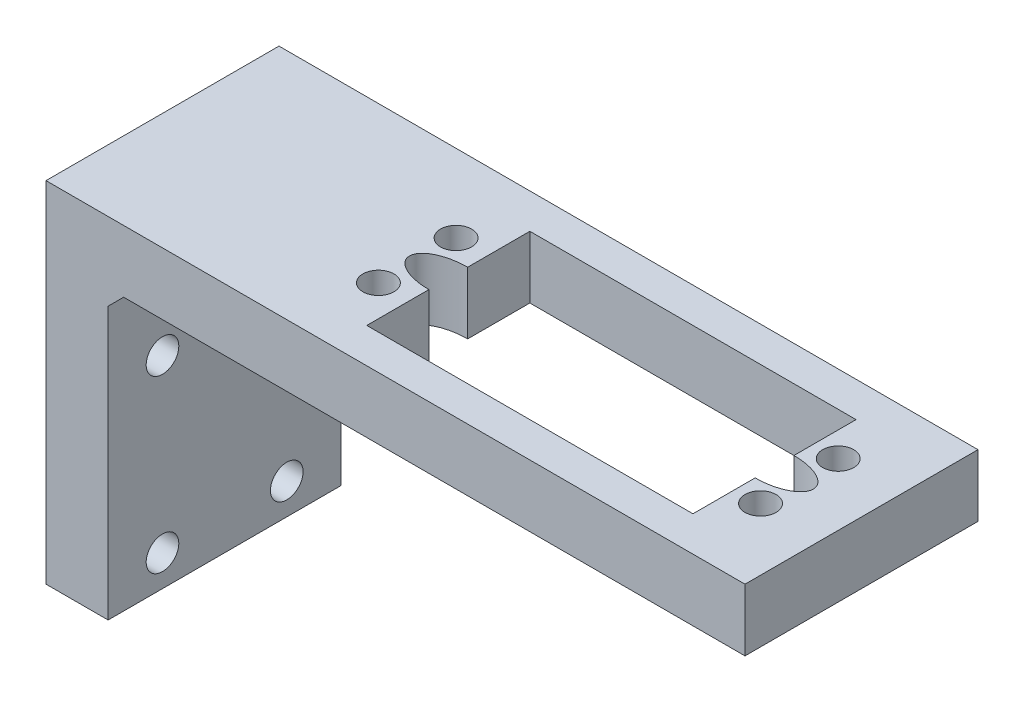
from build123d import *

# Parameters (mm, degrees)
SKETCH_1_W          = 82
SKETCH_1_H          = 30
EXTRUDE_1_DEPTH     = 8
SKETCH_2_R          = 2
CUT_EXTRUDE_1_DEPTH = 8
SKETCH_4_W          = 8
SKETCH_4_H          = 30
EXTRUDE_2_DEPTH     = 45
EXTRUDE_5_DEPTH     = 30
SKETCH_15_R         = 2.1
CUT_EXTRUDE_2_DEPTH = 10


with BuildPart() as part:
    # 草圖1 → 填料-伸長1 (new body)
    with BuildSketch(Plane(origin=(0, 0, 0), x_dir=(1, 0, 0), z_dir=(0, 1, 0))):
        with Locations((41, 15)):
            Rectangle(SKETCH_1_W, SKETCH_1_H)
    extrude(amount=EXTRUDE_1_DEPTH)

    # 草圖2 → 除料-伸長1 (cut)
    with BuildSketch(Plane(origin=(0, 8, 0), x_dir=(1, 0, 0), z_dir=(0, 1, 0))):
        with Locations(Location((74, 20, 0), (0, 0, 270))):
            Circle(SKETCH_2_R)
        with Locations(Location((74, 10, 0), (0, 0, 270))):
            Circle(SKETCH_2_R)
        with Locations(Location((24.8, 20, 0), (0, 0, 270))):
            Circle(SKETCH_2_R)
        with Locations(Location((24.8, 10, 0), (0, 0, 270))):
            Circle(SKETCH_2_R)
        with BuildLine():
            Line((28.8, 25.5), (70.8, 25.5))
            Line((70.8, 25.5), (70.8, 17.5))
            add(Edge.make_bspline(
                [(70.8, 12.5), (75.8, 12.5), (75.8, 15), (75.8, 17.5), (70.8, 17.5)],
                knots=[4.71238898, 4.71238898, 4.71238898, 6.283185307, 6.283185307, 7.853981634, 7.853981634, 7.853981634], degree=2, weights=[1, 0.707106781, 1, 0.707106781, 1]))
            Line((70.8, 12.5), (70.8, 4.5))
            Line((70.8, 4.5), (28.8, 4.5))
            Line((28.8, 4.5), (28.8, 12.5))
            add(Edge.make_bspline(
                [(28.8, 17.5), (23.8, 17.5), (23.8, 15), (23.8, 12.5), (28.8, 12.5)],
                knots=[1.570796327, 1.570796327, 1.570796327, 3.141592654, 3.141592654, 4.71238898, 4.71238898, 4.71238898], degree=2, weights=[1, 0.707106781, 1, 0.707106781, 1]))
            Line((28.8, 17.5), (28.8, 25.5))
        make_face()
    extrude(amount=-CUT_EXTRUDE_1_DEPTH, mode=Mode.SUBTRACT)

    # 草圖4 → 填料-伸長2 (add)
    with BuildSketch(Plane(origin=(0, 8, 0), x_dir=(1, 0, 0), z_dir=(0, 1, 0))):
        with Locations((-4, 15)):
            Rectangle(SKETCH_4_W, SKETCH_4_H)
    extrude(amount=-EXTRUDE_2_DEPTH)

    # 草圖14 → 填料-伸長5 (add)
    with BuildSketch(Plane.XY):
        Polygon((0, 0), (0, -2), (2, 0), align=None)
    extrude(amount=-EXTRUDE_5_DEPTH)

    # 草圖15 → 除料-伸長2 (cut)
    with BuildSketch(Plane(origin=(0, 0, 0), x_dir=(0, 0, -1), z_dir=(1, 0, 0))):
        with Locations((7, -33)):
            Circle(SKETCH_15_R)
        with Locations((7, -11)):
            Circle(SKETCH_15_R)
        with Locations((23, -11)):
            Circle(SKETCH_15_R)
        with Locations((23, -33)):
            Circle(SKETCH_15_R)
    extrude(amount=-CUT_EXTRUDE_2_DEPTH, mode=Mode.SUBTRACT)


solid = part.part
